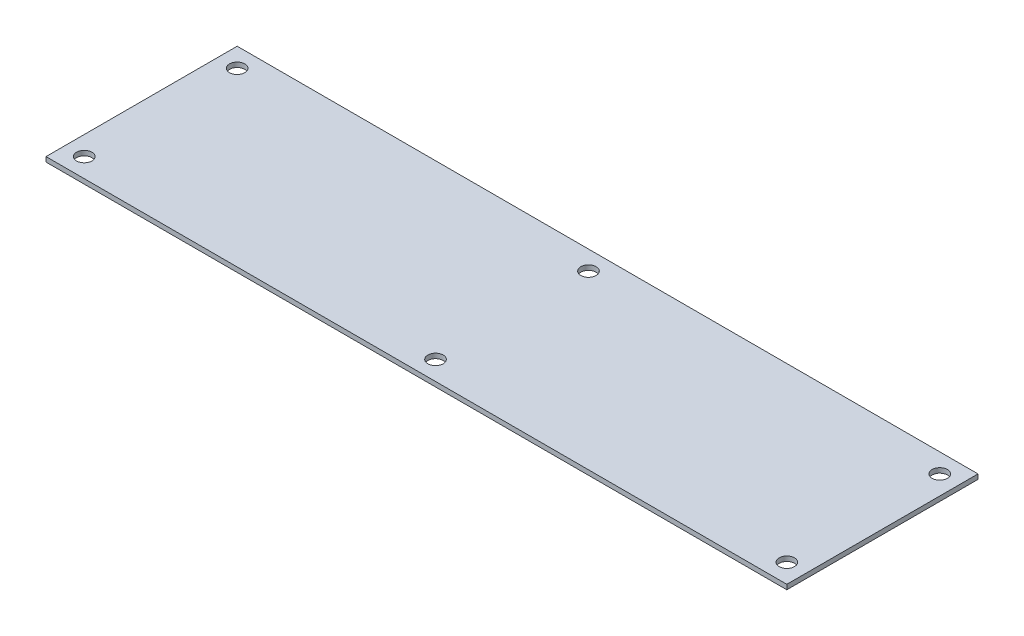
from build123d import *

# Parameters (mm, degrees)
SKETCH_1_W          = 155
SKETCH_1_H          = 40
EXTRUDE_1_DEPTH     = 1
SKETCH_2_R          = 1.6
CUT_EXTRUDE_1_DEPTH = 81.045299675


with BuildPart() as part:
    # Эскиз1 → Бобышка-Вытянуть1 (new body)
    with BuildSketch(Plane(origin=(0, 0, 0), x_dir=(1, 0, 0), z_dir=(0, 1, 0))):
        Rectangle(SKETCH_1_W, SKETCH_1_H)
    extrude(amount=EXTRUDE_1_DEPTH)

    # Эскиз2 → Вырез-Вытянуть1 (cut, through all)
    with BuildSketch(Plane(origin=(0, 1, 0), x_dir=(1, 0, 0), z_dir=(0, 1, 0))):
        with Locations(Location((-73.5, 16, 0), (0, 0, 270))):
            Circle(SKETCH_2_R)
        with Locations(Location((-73.5, -16, 0), (0, 0, 270))):
            Circle(SKETCH_2_R)
        with Locations(Location((73.5, 16, 0), (0, 0, 270))):
            Circle(SKETCH_2_R)
        with Locations(Location((73.5, -16, 0), (0, 0, 270))):
            Circle(SKETCH_2_R)
        with Locations(Location((0, 16, 0), (0, 0, 270))):
            Circle(SKETCH_2_R)
        with Locations(Location((0, -16, 0), (0, 0, 270))):
            Circle(SKETCH_2_R)
    extrude(amount=-CUT_EXTRUDE_1_DEPTH, mode=Mode.SUBTRACT)


solid = part.part
